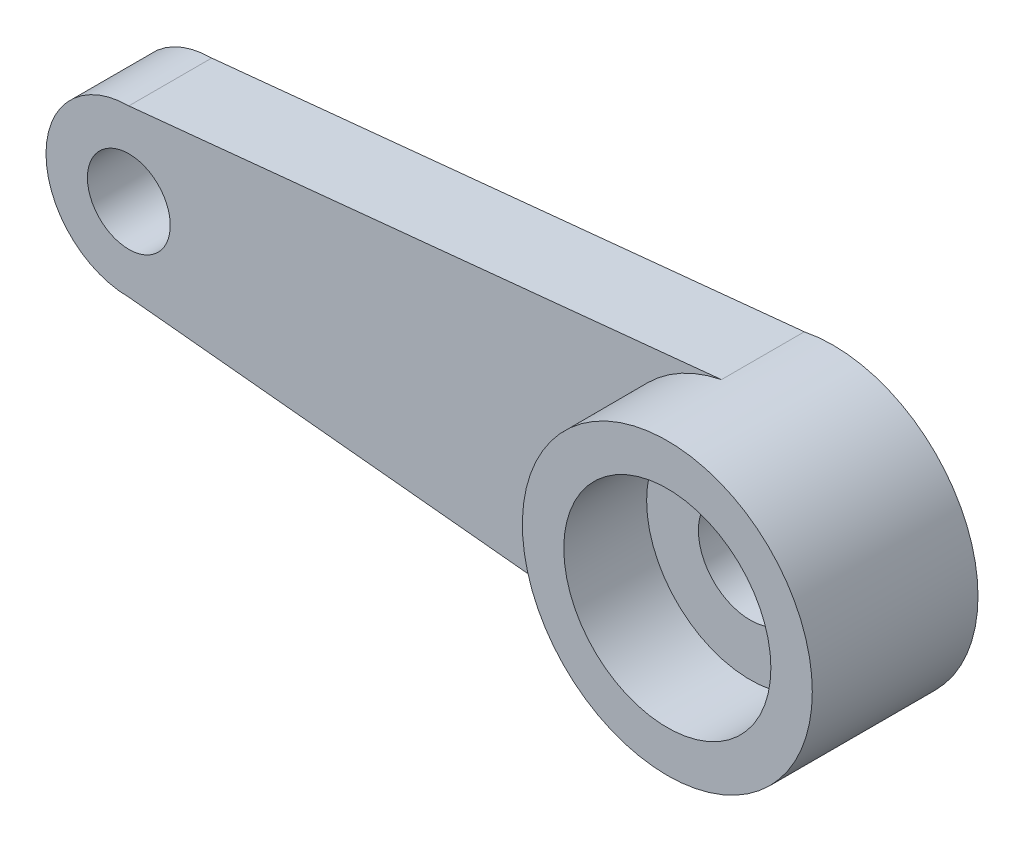
from build123d import *

# Parameters (mm, degrees)
SKETCH1_R           = 3.5
SKETCH1_R_2         = 2.5
BOSS_EXTRUDE1_DEPTH = 4
SKETCH2_R           = 1
BOSS_EXTRUDE2_DEPTH = 2
SKETCH3_R           = 2.5
SKETCH3_R_2         = 1.25
BOSS_EXTRUDE3_DEPTH = 2


with BuildPart() as part:
    # Sketch1 → Boss-Extrude1 (new body)
    with BuildSketch(Plane.XY):
        Circle(SKETCH1_R)
        Circle(SKETCH1_R_2, mode=Mode.SUBTRACT)
    extrude(amount=BOSS_EXTRUDE1_DEPTH)

    # Sketch2 → Boss-Extrude2 (add)
    with BuildSketch(Plane(origin=(0, 0, 0), x_dir=(-1, 0, 0), z_dir=(0, 0, -1))):
        with BuildLine():
            Line((15, 2), (0.693069307, 3.430693069))
            ThreePointArc((0.693069307, 3.430693069), (2.708850547, 2.216332266), (3.5, 0))
            ThreePointArc((3.5, 0), (2.708850547, -2.216332266), (0.693069307, -3.430693069))
            Line((0.693069307, -3.430693069), (15, -2))
            ThreePointArc((15, -2), (17, 0), (15, 2))
        make_face()
        with Locations((15, 0)):
            Circle(SKETCH2_R, mode=Mode.SUBTRACT)
    extrude(amount=-BOSS_EXTRUDE2_DEPTH)

    # Sketch3 → Boss-Extrude3 (add)
    with BuildSketch(Plane(origin=(0, 0, 0), x_dir=(-1, 0, 0), z_dir=(0, 0, -1))):
        Circle(SKETCH3_R)
        Circle(SKETCH3_R_2, mode=Mode.SUBTRACT)
    extrude(amount=-BOSS_EXTRUDE3_DEPTH)


solid = part.part
